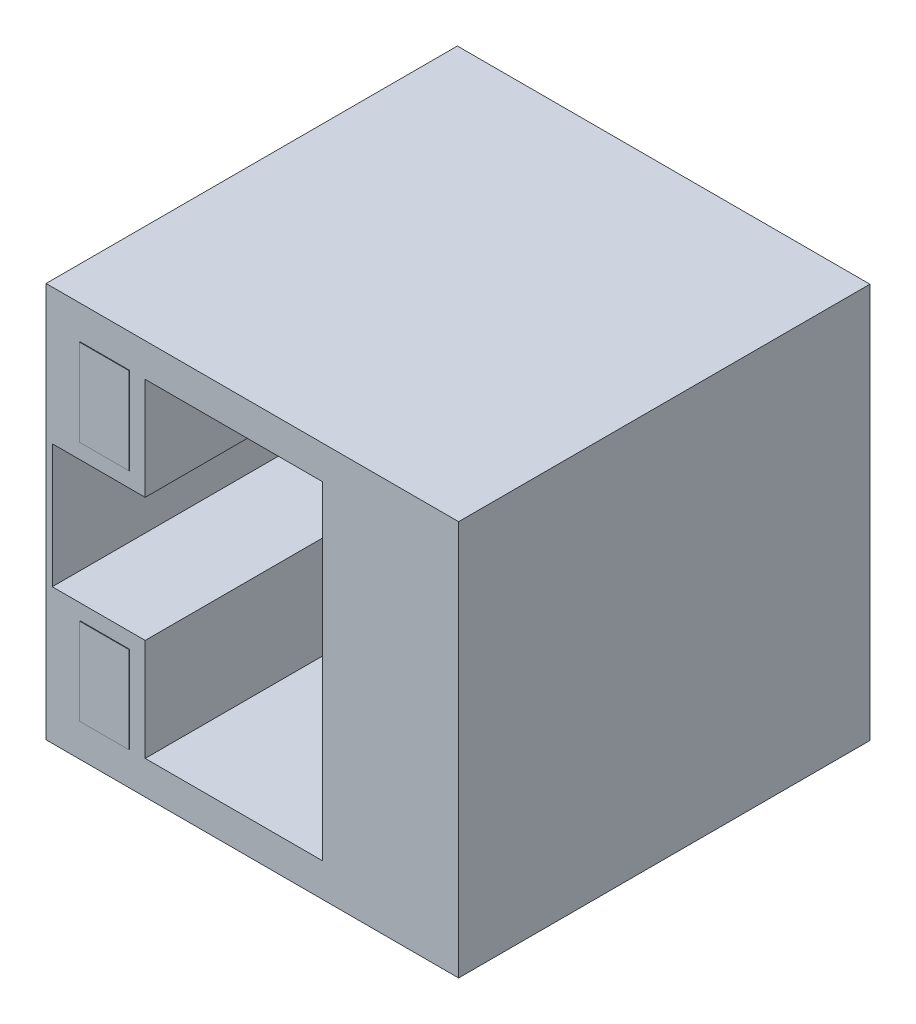
from build123d import *

# Parameters (mm, degrees)
SKETCH1_W           = 16.9164
SKETCH1_H           = 16.8656
BOSS_EXTRUDE1_DEPTH = 16.2052
BOSS_EXTRUDE2_REACH = 22.555
SKETCH2_W           = 2.032
SKETCH2_H           = 3.556
CUT_EXTRUDE1_REACH  = 17.522


with BuildPart() as part:
    # Sketch1 → Boss-Extrude1 (new body)
    with BuildSketch(Plane(origin=(0, 8.1026, 0), x_dir=(-1, 0, 0), z_dir=(0, 1, 0))):
        Rectangle(SKETCH1_W, SKETCH1_H)
    extrude(amount=-BOSS_EXTRUDE1_DEPTH)

    # Sketch2 → Boss-Extrude2 (add, up to next)
    with BuildSketch(Plane.XY.offset(8.4582), mode=Mode.PRIVATE) as boss_extrude2_sk1:
        with Locations((-6.0452, -4.953)):
            Rectangle(SKETCH2_W, SKETCH2_H)
    boss_extrude2_tool1 = extrude(boss_extrude2_sk1.sketch, amount=-BOSS_EXTRUDE2_REACH, mode=Mode.PRIVATE) - part.part
    # Sketch2 → Boss-Extrude2 (add, up to next)
    with BuildSketch(Plane.XY.offset(8.4582), mode=Mode.PRIVATE) as boss_extrude2_sk2:
        with Locations((-6.0452, 4.953)):
            Rectangle(SKETCH2_W, SKETCH2_H)
    boss_extrude2_tool2 = extrude(boss_extrude2_sk2.sketch, amount=-BOSS_EXTRUDE2_REACH, mode=Mode.PRIVATE) - part.part
    add(boss_extrude2_tool1.solids().sort_by_distance((-6.0452, -4.953, 8.4582))[0])
    add(boss_extrude2_tool2.solids().sort_by_distance((-6.0452, 4.953, 8.4582))[0])

    # Sketch3 → Cut-Extrude1 (cut, up to next)
    with BuildSketch(Plane(origin=(0, 0, -1.7272), x_dir=(-1, 0, 0), z_dir=(0, 0, -1)), mode=Mode.PRIVATE) as cut_extrude1_sk1:
        Polygon((8.2042, 2.54), (4.3942, 2.54), (4.3942, 6.731), (-2.8702, 6.731), (-2.8702, -6.731), (4.3942, -6.731), (4.3942, -2.54), (8.2042, -2.54), align=None)
    cut_extrude1_tool1 = extrude(cut_extrude1_sk1.sketch, amount=-CUT_EXTRUDE1_REACH, mode=Mode.PRIVATE) & part.part
    add(cut_extrude1_tool1.solids().sort_by_distance((-1.676836, 0, -1.7272))[0], mode=Mode.SUBTRACT)


solid = part.part
